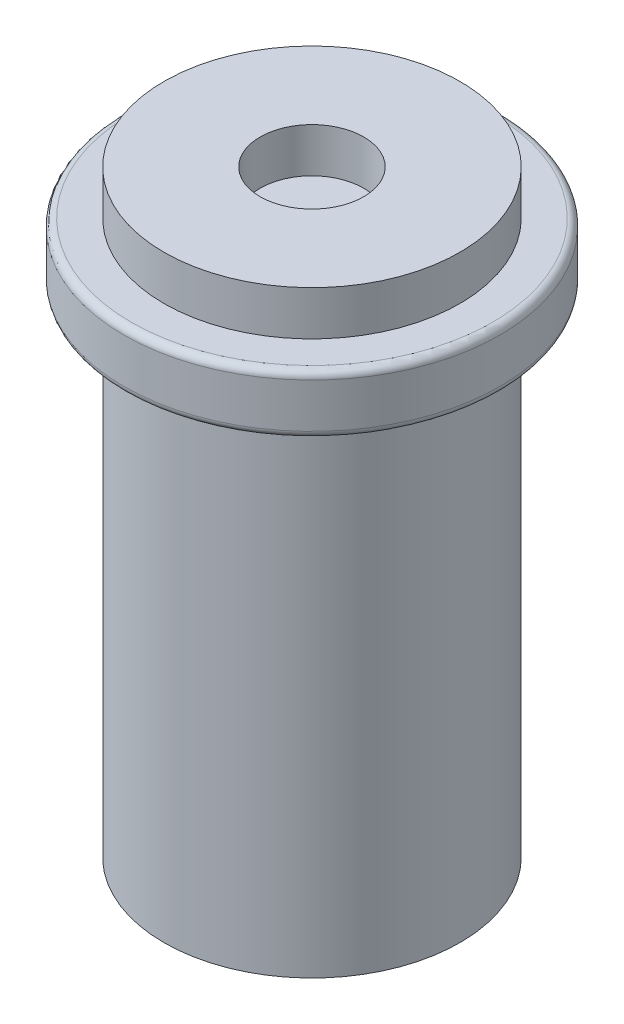
from build123d import *

# Parameters (mm, degrees)
EXTRUDE_START       = 15
SKETCH_1_R          = 10
EXTRUDE_1_DEPTH     = 40.4
SKETCH_2_R          = 3.5
CUT_EXTRUDE_1_DEPTH = 34
SKETCH_3_R          = 12.7
EXTRUDE_2_DEPTH     = 4
FILLET_4_R          = 0.5


with BuildPart() as part:
    # Эскиз1 → Вытянуть1 (new body)
    with BuildSketch(Plane(origin=(0, 0, 0), x_dir=(1, 0, 0), z_dir=(0, 1, 0)).offset(EXTRUDE_START)):
        with Locations(Location((0, 0, 0), (0, 0, 270))):
            Circle(SKETCH_1_R)
    extrude(amount=EXTRUDE_1_DEPTH)

    # Эскиз2 → Вырез-Вытянуть1 (cut)
    with BuildSketch(Plane(origin=(0, 55.4, 0), x_dir=(1, 0, 0), z_dir=(0, 1, 0))):
        with Locations(Location((0, 0, 0), (0, 0, 270))):
            Circle(SKETCH_2_R)
    extrude(amount=-CUT_EXTRUDE_1_DEPTH, mode=Mode.SUBTRACT)

    # Эскиз3 → Вытянуть2 (add)
    with BuildSketch(Plane(origin=(0, 52.4, 0), x_dir=(-1, 0, 0), z_dir=(0, 1, 0))):
        with Locations(Location((0, 0, 0), (0, 0, 90))):
            Circle(SKETCH_3_R)
    extrude(amount=-EXTRUDE_2_DEPTH)

    # Скругление4
    fillet_4_edges = [part.edges().sort_by_distance(p)[0] for p in [
        (0, 52.4, -12.7),
        (0, 48.4, -12.7),
    ]]
    fillet(fillet_4_edges, radius=FILLET_4_R)


solid = part.part
